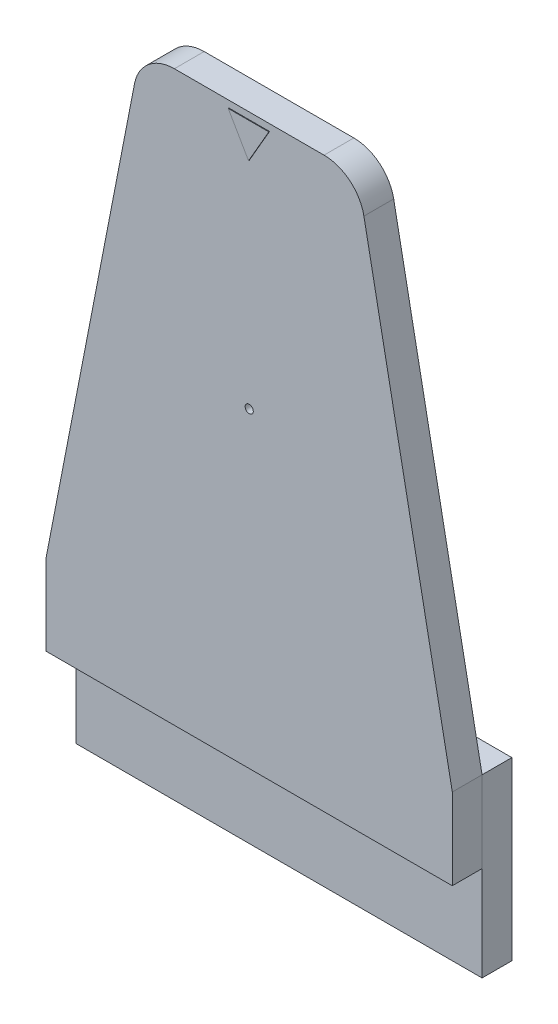
from build123d import *

# Parameters (mm, degrees)
ESQUISSE1_R        = 3
BOSS_EXTRU_1_DEPTH = 22
ESQUISSE2_W        = 300
ESQUISSE2_H        = 130
BOSS_EXTRU_2_DEPTH = 22
BOSS_EXTRU_3_DEPTH = 0.5


with BuildPart() as part:
    # Esquisse1 → Boss.-Extru.1 (new body)
    with BuildSketch(Plane.XY):
        with BuildLine():
            Line((150, 60), (84.719926989, 395.726089773))
            ThreePointArc((84.719926989, 395.726089773), (74.353096607, 413.149327131), (55.271465299, 420))
            Line((55.271465299, 420), (-55.271465299, 420))
            ThreePointArc((-55.271465299, 420), (-74.353096607, 413.149327131), (-84.719926989, 395.726089773))
            Line((-84.719926989, 395.726089773), (-150, 60))
            Line((-150, 60), (-150, 0))
            Line((-150, 0), (150, 0))
            Line((150, 0), (150, 60))
        make_face()
        with Locations((0, 230)):
            Circle(ESQUISSE1_R, mode=Mode.SUBTRACT)
    extrude(amount=BOSS_EXTRU_1_DEPTH)


with BuildPart() as body_2:
    # Esquisse2 → Boss.-Extru.2 (new body)
    with BuildSketch(Plane(origin=(0, 0, 0), x_dir=(-1, 0, 0), z_dir=(0, 0, -1))):
        with Locations((0, -5)):
            Rectangle(ESQUISSE2_W, ESQUISSE2_H)
    extrude(amount=BOSS_EXTRU_2_DEPTH)


with BuildPart() as body_3:
    # Esquisse3 → Boss.-Extru.3 (new body)
    with BuildSketch(Plane.XY.offset(22)):
        Polygon((-15, 415), (15, 415), (0, 389.019237886), align=None)
    extrude(amount=BOSS_EXTRU_3_DEPTH)


solid = Compound([part.part, body_2.part, body_3.part])
